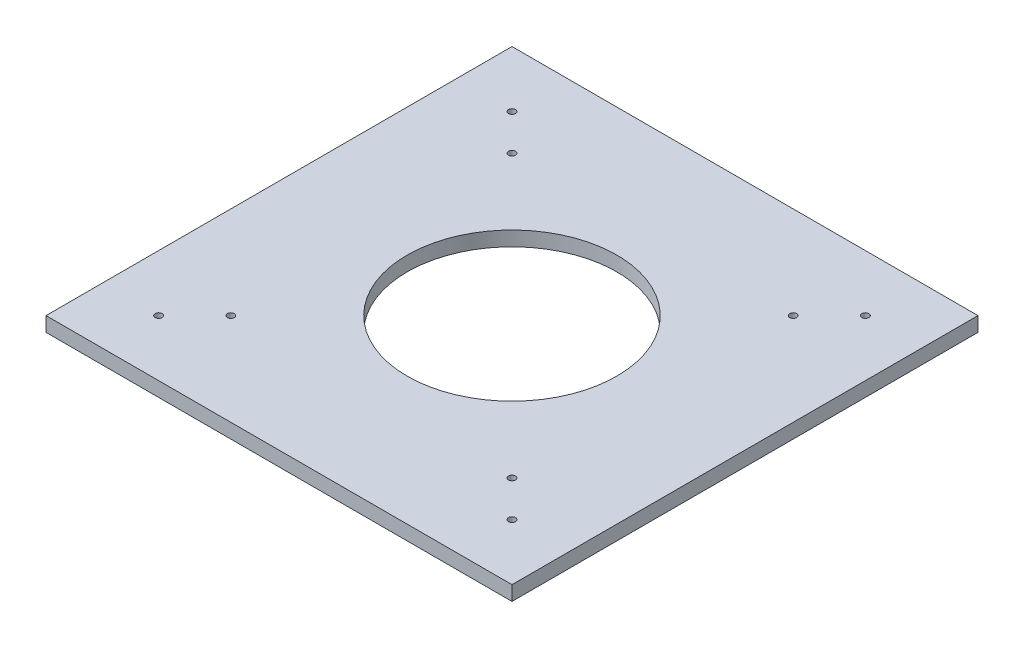
from build123d import *

# Parameters (mm, degrees)
SKETCH1_W           = 160
SKETCH1_H           = 160
SKETCH1_R           = 1.2
SKETCH1_R_2         = 36
BOSS_EXTRUDE1_DEPTH = 5


with BuildPart() as part:
    # Sketch1 → Boss-Extrude1 (new body)
    with BuildSketch(Plane(origin=(0, 0, 0), x_dir=(1, 0, 0), z_dir=(0, 1, 0))):
        Rectangle(SKETCH1_W, SKETCH1_H)
        with Locations(Location((-60.664206642, 60.664206642, 0), (0, 0, 270))):
            Circle(SKETCH1_R, mode=Mode.SUBTRACT)
        with Locations(Location((-48.279552135, 48.279552135, 0), (0, 0, 270))):
            Circle(SKETCH1_R, mode=Mode.SUBTRACT)
        with Locations(Location((48.279552135, 48.279552135, 0), (0, 0, 90))):
            Circle(SKETCH1_R, mode=Mode.SUBTRACT)
        with Locations(Location((60.664206642, 60.664206642, 0), (0, 0, 90))):
            Circle(SKETCH1_R, mode=Mode.SUBTRACT)
        with Locations(Location((60.664206642, -60.664206642, 0), (0, 0, 270))):
            Circle(SKETCH1_R, mode=Mode.SUBTRACT)
        with Locations(Location((48.279552135, -48.279552135, 0), (0, 0, 270))):
            Circle(SKETCH1_R, mode=Mode.SUBTRACT)
        with Locations(Location((-48.279552135, -48.279552135, 0), (0, 0, 90))):
            Circle(SKETCH1_R, mode=Mode.SUBTRACT)
        with Locations(Location((-60.664206642, -60.664206642, 0), (0, 0, 90))):
            Circle(SKETCH1_R, mode=Mode.SUBTRACT)
        with Locations(Location((0, 0, 0), (0, 0, 270))):
            Circle(SKETCH1_R_2, mode=Mode.SUBTRACT)
    extrude(amount=BOSS_EXTRUDE1_DEPTH)


solid = part.part
